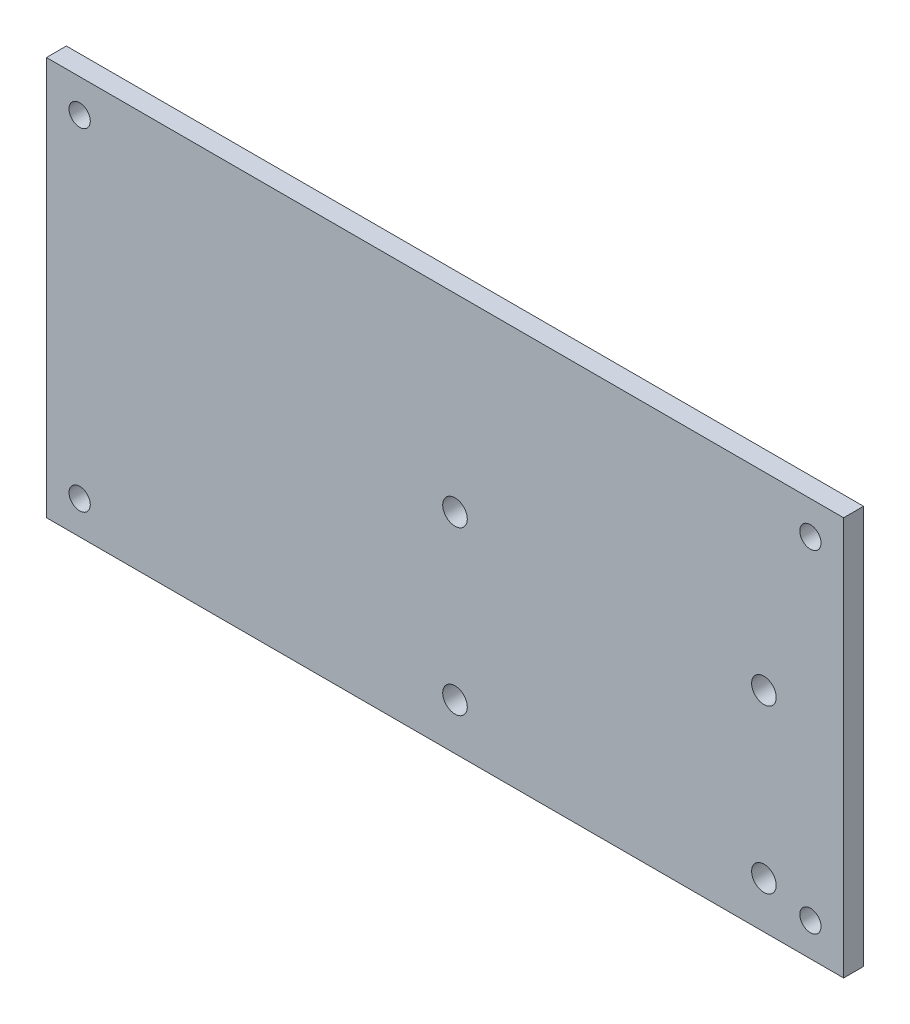
from build123d import *

# Parameters (mm, degrees)
SKETCH1_W           = 120
SKETCH1_H           = 60
BOSS_EXTRUDE1_DEPTH = 3
SKETCH3_R           = 1.85
CUT_EXTRUDE1_DEPTH  = 73.520148402
SKETCH4_R           = 1.5
CUT_EXTRUDE2_DEPTH  = 73.520148402
SKETCH5_R           = 1.6
CUT_EXTRUDE3_DEPTH  = 10


with BuildPart() as part:
    # Sketch1 → Boss-Extrude1 (new body)
    with BuildSketch(Plane.XY):
        with Locations((3.092575742, -5.63002681)):
            Rectangle(SKETCH1_W, SKETCH1_H)
    extrude(amount=BOSS_EXTRUDE1_DEPTH)

    # Sketch3 → Cut-Extrude1 (cut, through all)
    with BuildSketch(Plane.XY.offset(3)):
        with Locations((4.592575742, -4.13002681)):
            Circle(SKETCH3_R)
        with Locations((51.092575742, -4.13002681)):
            Circle(SKETCH3_R)
        with Locations((51.092575742, -28.63002681)):
            Circle(SKETCH3_R)
        with Locations((4.592575742, -28.63002681)):
            Circle(SKETCH3_R)
    extrude(amount=-CUT_EXTRUDE1_DEPTH, mode=Mode.SUBTRACT)

    # Sketch4 → Cut-Extrude2 (cut, through all)
    with BuildSketch(Plane.XY.offset(3)):
        with Locations((-51.907424258, 19.36997319)):
            Circle(SKETCH4_R)
        with Locations((58.092575742, 19.36997319)):
            Circle(SKETCH4_R)
        with Locations((58.092575742, -30.63002681)):
            Circle(SKETCH4_R)
        with Locations((-51.907424258, -30.63002681)):
            Circle(SKETCH4_R)
    extrude(amount=-CUT_EXTRUDE2_DEPTH, mode=Mode.SUBTRACT)

    # Sketch5 → Cut-Extrude3 (cut)
    with BuildSketch(Plane(origin=(0, 0, 0), x_dir=(-1, 0, 0), z_dir=(0, 0, -1))):
        with Locations((-58.092575742, 19.36997319)):
            Circle(SKETCH5_R)
        with Locations((-58.092575742, -30.63002681)):
            Circle(SKETCH5_R)
        with Locations((51.907424258, -30.63002681)):
            Circle(SKETCH5_R)
        with Locations((51.907424258, 19.36997319)):
            Circle(SKETCH5_R)
    extrude(amount=-CUT_EXTRUDE3_DEPTH, mode=Mode.SUBTRACT)


solid = part.part
